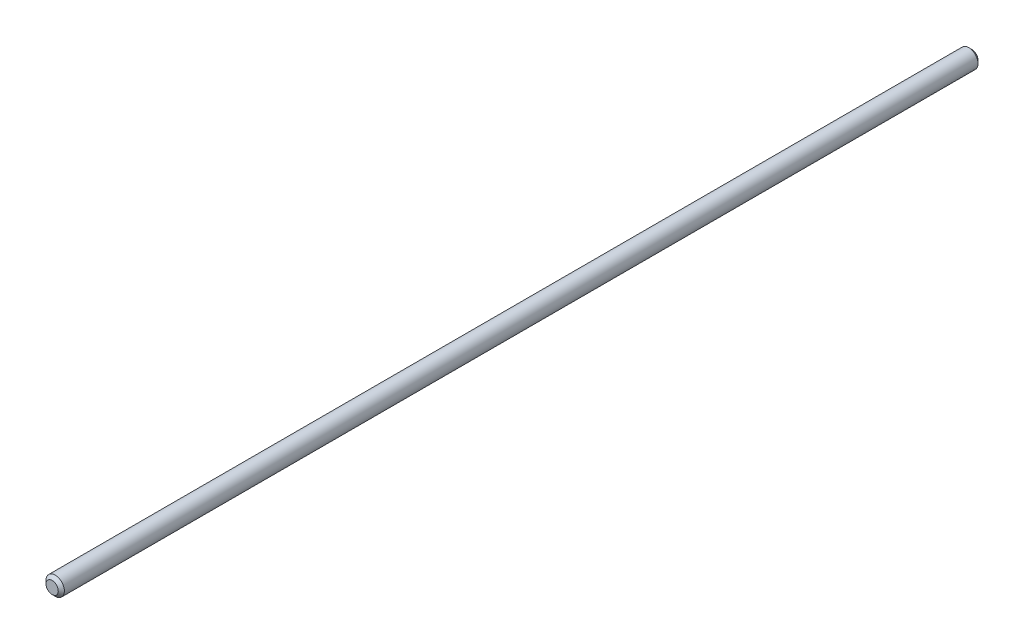
from build123d import *

# Parameters (mm, degrees)
SKETCH1_R           = 1.5
BOSS_EXTRUDE1_DEPTH = 150
CHAMFER1_SIZE       = 0.5


with BuildPart() as part:
    # Sketch1 → Boss-Extrude1 (new body)
    with BuildSketch(Plane.XY):
        Circle(SKETCH1_R)
    extrude(amount=BOSS_EXTRUDE1_DEPTH)

    # Chamfer1
    chamfer1_edges = [part.edges().sort_by_distance(p)[0] for p in [
        (-1.5, 0, 0),
        (-1.5, 0, 150),
    ]]
    chamfer(chamfer1_edges, length=CHAMFER1_SIZE)


solid = part.part
